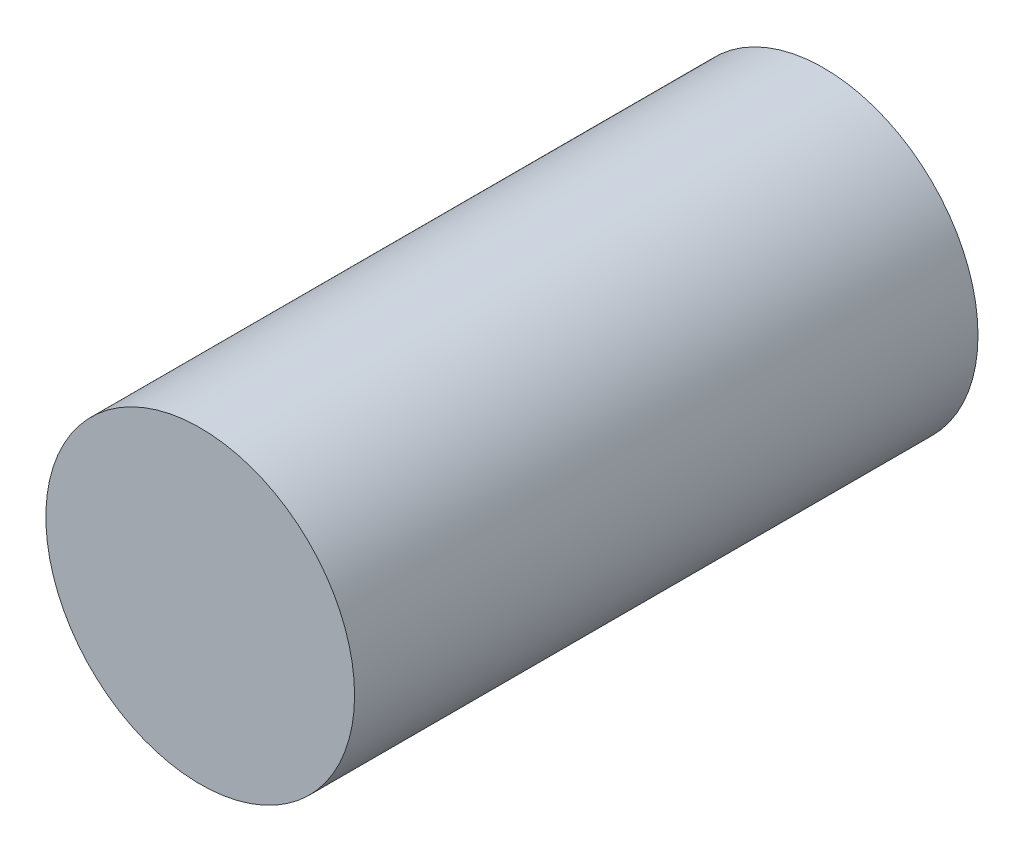
from build123d import *

# Parameters (mm, degrees)
SKETCH1_R           = 9.904011466
BOSS_EXTRUDE1_DEPTH = 40


with BuildPart() as part:
    # Sketch1 → Boss-Extrude1 (new body)
    with BuildSketch(Plane.XY):
        Circle(SKETCH1_R)
    extrude(amount=BOSS_EXTRUDE1_DEPTH)


solid = part.part
